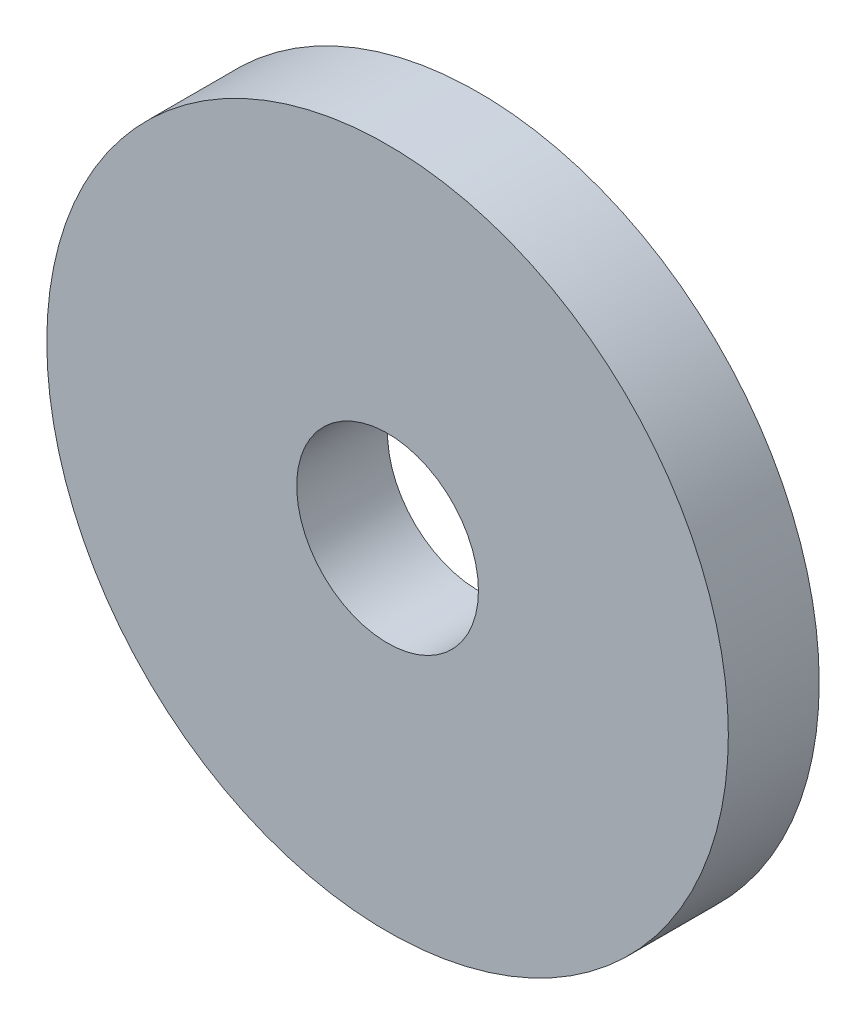
from build123d import *

# Parameters (mm, degrees)
SKETCH_1_R      = 7.5
SKETCH_1_R_2    = 2
EXTRUDE_1_DEPTH = 2


with BuildPart() as part:
    # 草图1 → 凸台-拉伸1 (new body)
    with BuildSketch(Plane.XY):
        Circle(SKETCH_1_R)
        Circle(SKETCH_1_R_2, mode=Mode.SUBTRACT)
    extrude(amount=EXTRUDE_1_DEPTH)


solid = part.part
